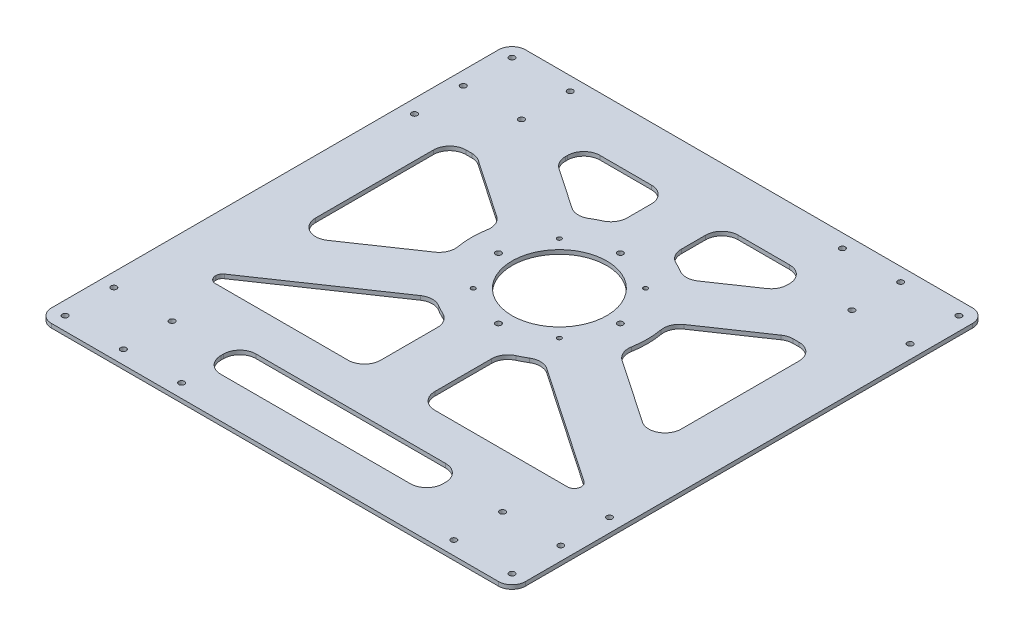
from build123d import *

# Parameters (mm, degrees)
SKETCH1_W           = 350
SKETCH1_H           = 350
BOSS_EXTRUDE1_DEPTH = 3
FILLET1_R           = 10
SKETCH2_R           = 2.1
CUT_EXTRUDE1_DEPTH  = 495.98383812
SKETCH3_W           = 62
SKETCH3_H           = 46
SKETCH3_W_2         = 40
SKETCH3_W_3         = 164
SKETCH3_H_2         = 10
CUT_EXTRUDE2_DEPTH  = 10
SKETCH6_W           = 164
SKETCH6_H           = 30
BOSS_EXTRUDE2_DEPTH = 3
FILLET2_R           = 12
FILLET3_R           = 5
SKETCH5_R           = 2.1
SKETCH5_R_2         = 1.6
CUT_EXTRUDE4_DEPTH  = 10


with BuildPart() as part:
    # Sketch1 → Boss-Extrude1 (new body)
    with BuildSketch(Plane(origin=(0, 0, 0), x_dir=(1, 0, 0), z_dir=(0, 1, 0))):
        with Locations((175, 175)):
            Rectangle(SKETCH1_W, SKETCH1_H)
    extrude(amount=BOSS_EXTRUDE1_DEPTH)

    # Fillet1
    fillet1_edges = [part.edges().sort_by_distance(p)[0] for p in [
        (0, 1.5, -350),
        (350, 1.5, -350),
        (350, 1.5, 0),
        (0, 1.5, 0),
    ]]
    fillet(fillet1_edges, radius=FILLET1_R)

    # Sketch2 → Cut-Extrude1 (cut, through all)
    with BuildSketch(Plane(origin=(0, 3, 0), x_dir=(1, 0, 0), z_dir=(0, 1, 0))):
        with Locations(Location((10, 340, 0), (0, 0, 270))):
            Circle(SKETCH2_R)
        with Locations(Location((53, 340, 0), (0, 0, 270))):
            Circle(SKETCH2_R)
        with Locations(Location((53, 304, 0), (0, 0, 270))):
            Circle(SKETCH2_R)
        with Locations(Location((10, 304, 0), (0, 0, 270))):
            Circle(SKETCH2_R)
        with Locations(Location((254, 340, 0), (0, 0, 270))):
            Circle(SKETCH2_R)
        with Locations(Location((340, 82, 0), (0, 0, 270))):
            Circle(SKETCH2_R)
        with Locations(Location((297, 304, 0), (0, 0, 90))):
            Circle(SKETCH2_R)
        with Locations(Location((340, 304, 0), (0, 0, 90))):
            Circle(SKETCH2_R)
        with Locations(Location((297, 340, 0), (0, 0, 90))):
            Circle(SKETCH2_R)
        with Locations(Location((340, 340, 0), (0, 0, 90))):
            Circle(SKETCH2_R)
        with Locations(Location((340, 10, 0), (0, 0, 270))):
            Circle(SKETCH2_R)
        with Locations(Location((340, 46, 0), (0, 0, 270))):
            Circle(SKETCH2_R)
        with Locations(Location((297, 10, 0), (0, 0, 270))):
            Circle(SKETCH2_R)
        with Locations(Location((297, 46, 0), (0, 0, 270))):
            Circle(SKETCH2_R)
        with Locations(Location((53, 10, 0), (0, 0, 90))):
            Circle(SKETCH2_R)
        with Locations(Location((53, 46, 0), (0, 0, 90))):
            Circle(SKETCH2_R)
        with Locations(Location((10, 46, 0), (0, 0, 90))):
            Circle(SKETCH2_R)
        with Locations(Location((10, 10, 0), (0, 0, 90))):
            Circle(SKETCH2_R)
        with Locations(Location((96, 10, 0), (0, 0, 270))):
            Circle(SKETCH2_R)
        with Locations(Location((10, 268, 0), (0, 0, 270))):
            Circle(SKETCH2_R)
    extrude(amount=-CUT_EXTRUDE1_DEPTH, mode=Mode.SUBTRACT)

    # Sketch3 → Cut-Extrude2 (cut)
    with BuildSketch(Plane(origin=(0, 3, 0), x_dir=(1, 0, 0), z_dir=(0, 1, 0))):
        with BuildLine():
            Line((93, 310), (93, 290))
            Line((93, 290), (131.202728132, 264))
            Line((131.202728132, 264), (138.81989497, 264))
            ThreePointArc((138.81989497, 264), (146.637290822, 268.4855258), (155, 271.846584384))
            Line((155, 271.846584384), (155, 310))
            Line((155, 310), (93, 310))
        make_face()
        with BuildLine():
            Line((257, 310), (195, 310))
            Line((195, 310), (195, 271.846584384))
            ThreePointArc((195, 271.846584384), (203.362709178, 268.4855258), (211.18010503, 264))
            Line((211.18010503, 264), (218.797271868, 264))
            Line((218.797271868, 264), (257, 290))
            Line((257, 290), (257, 310))
        make_face()
        with BuildLine():
            Line((138.81989497, 264), (131.202728132, 264))
            Line((131.202728132, 264), (135.12395886, 261.331290096))
            ThreePointArc((135.12395886, 261.331290096), (136.948523738, 262.698056456), (138.81989497, 264))
        make_face()
        with BuildLine():
            Line((218.797271868, 264), (211.18010503, 264))
            ThreePointArc((211.18010503, 264), (213.051476262, 262.698056456), (214.87604114, 261.331290096))
            Line((214.87604114, 261.331290096), (218.797271868, 264))
        make_face()
        Polygon((93, 241.615065428), (60.109016549, 264), (40, 264), (40, 142.314212208), (93, 178.384934572), align=None)
        with BuildLine():
            Line((112.618452193, 228.263145763), (93, 241.615065428))
            Line((93, 241.615065428), (93, 178.384934572))
            Line((93, 178.384934572), (112.618452193, 191.736854237))
            ThreePointArc((112.618452193, 191.736854237), (110, 210), (112.618452193, 228.263145763))
        make_face()
        with BuildLine():
            Line((257, 241.615065428), (237.381547807, 228.263145763))
            ThreePointArc((237.381547807, 228.263145763), (239.342057037, 219.224949662), (240, 210))
            ThreePointArc((240, 210), (239.342057037, 200.775050338), (237.381547807, 191.736854237))
            Line((237.381547807, 191.736854237), (257, 178.384934572))
            Line((257, 178.384934572), (257, 241.615065428))
        make_face()
        Polygon((310, 264), (289.890983451, 264), (257, 241.615065428), (257, 178.384934572), (310, 142.314212208), align=None)
        Polygon((257, 130), (257, 86), (310, 86), (310, 93.929277636), align=None)
        with BuildLine():
            ThreePointArc((214.87604114, 158.668709904), (205.396182806, 152.545043113), (195, 148.153415616))
            Line((195, 148.153415616), (195, 86))
            Line((195, 86), (257, 86))
            Line((257, 86), (257, 130))
            Line((257, 130), (214.87604114, 158.668709904))
        make_face()
        Polygon((93, 86), (93, 130), (40, 93.929277636), (40, 86), align=None)
        with BuildLine():
            Line((135.12395886, 158.668709904), (93, 130))
            Line((93, 130), (93, 86))
            Line((93, 86), (155, 86))
            Line((155, 86), (155, 148.153415616))
            ThreePointArc((155, 148.153415616), (144.603817194, 152.545043113), (135.12395886, 158.668709904))
        make_face()
        with BuildLine():
            Line((187.492500008, 242.694608784), (175, 234.192467286))
            Line((175, 234.192467286), (195, 220.580873941))
            Line((195, 220.580873941), (195, 238.722813233))
            ThreePointArc((195, 238.722813233), (191.367175357, 240.937284477), (187.492500008, 242.694608784))
        make_face()
        with BuildLine():
            Line((195, 238.722813233), (195, 220.580873941))
            Line((195, 220.580873941), (209.998006675, 210.373535549))
            ThreePointArc((209.998006675, 210.373535549), (205.937284477, 226.367175357), (195, 238.722813233))
        make_face()
        with BuildLine():
            ThreePointArc((187.492500008, 242.694608784), (175, 245), (162.507499992, 242.694608784))
            Line((162.507499992, 242.694608784), (175, 234.192467286))
            Line((175, 234.192467286), (187.492500008, 242.694608784))
        make_face()
        with BuildLine():
            Line((155, 220.580873941), (155, 238.722813233))
            ThreePointArc((155, 238.722813233), (144.062715523, 226.367175357), (140.001993325, 210.373535549))
            Line((140.001993325, 210.373535549), (155, 220.580873941))
        make_face()
        with BuildLine():
            Line((175, 234.192467286), (162.507499992, 242.694608784))
            ThreePointArc((162.507499992, 242.694608784), (158.632824643, 240.937284477), (155, 238.722813233))
            Line((155, 238.722813233), (155, 220.580873941))
            Line((155, 220.580873941), (175, 234.192467286))
        make_face()
        Polygon((195, 220.580873941), (175, 234.192467286), (155, 220.580873941), (155, 199.419126059), (175, 185.807532714), (195, 199.419126059), align=None)
        with BuildLine():
            Line((155, 199.419126059), (155, 220.580873941))
            Line((155, 220.580873941), (140.001993325, 210.373535549))
            ThreePointArc((140.001993325, 210.373535549), (140, 210), (140.001993325, 209.626464451))
            Line((140.001993325, 209.626464451), (155, 199.419126059))
        make_face()
        with BuildLine():
            Line((155, 199.419126059), (140.001993325, 209.626464451))
            ThreePointArc((140.001993325, 209.626464451), (144.062715523, 193.632824643), (155, 181.277186767))
            Line((155, 181.277186767), (155, 199.419126059))
        make_face()
        with BuildLine():
            Line((175, 185.807532714), (155, 199.419126059))
            Line((155, 199.419126059), (155, 181.277186767))
            ThreePointArc((155, 181.277186767), (158.632824643, 179.062715523), (162.507499992, 177.305391216))
            Line((162.507499992, 177.305391216), (175, 185.807532714))
        make_face()
        with BuildLine():
            Line((187.492500008, 177.305391216), (175, 185.807532714))
            Line((175, 185.807532714), (162.507499992, 177.305391216))
            ThreePointArc((162.507499992, 177.305391216), (175, 175), (187.492500008, 177.305391216))
        make_face()
        with BuildLine():
            Line((195, 181.277186767), (195, 199.419126059))
            Line((195, 199.419126059), (175, 185.807532714))
            Line((175, 185.807532714), (187.492500008, 177.305391216))
            ThreePointArc((187.492500008, 177.305391216), (191.367175357, 179.062715523), (195, 181.277186767))
        make_face()
        with BuildLine():
            Line((209.998006675, 209.626464451), (195, 199.419126059))
            Line((195, 199.419126059), (195, 181.277186767))
            ThreePointArc((195, 181.277186767), (205.937284477, 193.632824643), (209.998006675, 209.626464451))
        make_face()
        with BuildLine():
            Line((209.998006675, 210.373535549), (195, 220.580873941))
            Line((195, 220.580873941), (195, 199.419126059))
            Line((195, 199.419126059), (209.998006675, 209.626464451))
            ThreePointArc((209.998006675, 209.626464451), (209.999501665, 209.813229566), (210, 210))
            ThreePointArc((210, 210), (209.999501665, 210.186770434), (209.998006675, 210.373535549))
        make_face()
        with Locations((226, 63)):
            Rectangle(SKETCH3_W, SKETCH3_H)
        with Locations((124, 63)):
            Rectangle(SKETCH3_W, SKETCH3_H)
        with Locations((175, 63)):
            Rectangle(SKETCH3_W_2, SKETCH3_H)
        with Locations((175, 35)):
            Rectangle(SKETCH3_W_3, SKETCH3_H_2)
    extrude(amount=-CUT_EXTRUDE2_DEPTH, mode=Mode.SUBTRACT)

    # Sketch6 → Boss-Extrude2 (add)
    with BuildSketch(Plane(origin=(0, 3, 0), x_dir=(1, 0, 0), z_dir=(0, 1, 0))):
        with Locations((175, 71)):
            Rectangle(SKETCH6_W, SKETCH6_H)
    extrude(amount=-BOSS_EXTRUDE2_DEPTH)

    # Fillet2
    fillet2_edges = [part.edges().sort_by_distance(p)[0] for p in [
        (237.381547807, 1.5, -191.736854237),
        (237.381547807, 1.5, -228.263145763),
        (289.890983451, 1.5, -264),
        (310, 1.5, -264),
        (310, 1.5, -142.314212208),
        (112.618452193, 1.5, -191.736854237),
        (40, 1.5, -142.314212208),
        (40, 1.5, -264),
        (60.109016549, 1.5, -264),
        (112.618452193, 1.5, -228.263145763),
        (214.87604114, 1.5, -261.331290096),
        (195, 1.5, -271.846584384),
        (195, 1.5, -310),
        (257, 1.5, -310),
        (257, 1.5, -290),
        (214.87604114, 1.5, -158.668709904),
        (257, 1.5, -30),
        (93, 1.5, -30),
        (135.12395886, 1.5, -158.668709904),
        (155, 1.5, -148.153415616),
        (155, 1.5, -86),
        (195, 1.5, -86),
        (195, 1.5, -148.153415616),
        (155, 1.5, -271.846584384),
        (135.12395886, 1.5, -261.331290096),
        (93, 1.5, -290),
        (93, 1.5, -310),
        (155, 1.5, -310),
        (257, 1.5, -56),
        (93, 1.5, -56),
    ]]
    fillet(fillet2_edges, radius=FILLET2_R)

    # Fillet3
    fillet3_edges = [part.edges().sort_by_distance(p)[0] for p in [
        (310, 1.5, -93.929277636),
        (310, 1.5, -86),
        (40, 1.5, -86),
        (40, 1.5, -93.929277636),
    ]]
    fillet(fillet3_edges, radius=FILLET3_R)

    # Sketch5 → Cut-Extrude4 (cut)
    with BuildSketch(Plane(origin=(0, 3, 0), x_dir=(1, 0, 0), z_dir=(0, 1, 0))):
        with Locations(Location((175, 255, 0), (0, 0, 270))):
            Circle(SKETCH5_R)
        with Locations(Location((220, 210, 0), (0, 0, 270))):
            Circle(SKETCH5_R)
        with Locations(Location((175, 165, 0), (0, 0, 270))):
            Circle(SKETCH5_R)
        with Locations(Location((130, 210, 0), (0, 0, 270))):
            Circle(SKETCH5_R)
        with Locations(Location((206.819805153, 241.819805153, 0), (0, 0, 270))):
            Circle(SKETCH5_R_2)
        with Locations(Location((206.819805153, 178.180194847, 0), (0, 0, 270))):
            Circle(SKETCH5_R_2)
        with Locations(Location((143.180194847, 178.180194847, 0), (0, 0, 270))):
            Circle(SKETCH5_R_2)
        with Locations(Location((143.180194847, 241.819805153, 0), (0, 0, 270))):
            Circle(SKETCH5_R_2)
    extrude(amount=-CUT_EXTRUDE4_DEPTH, mode=Mode.SUBTRACT)


solid = part.part
